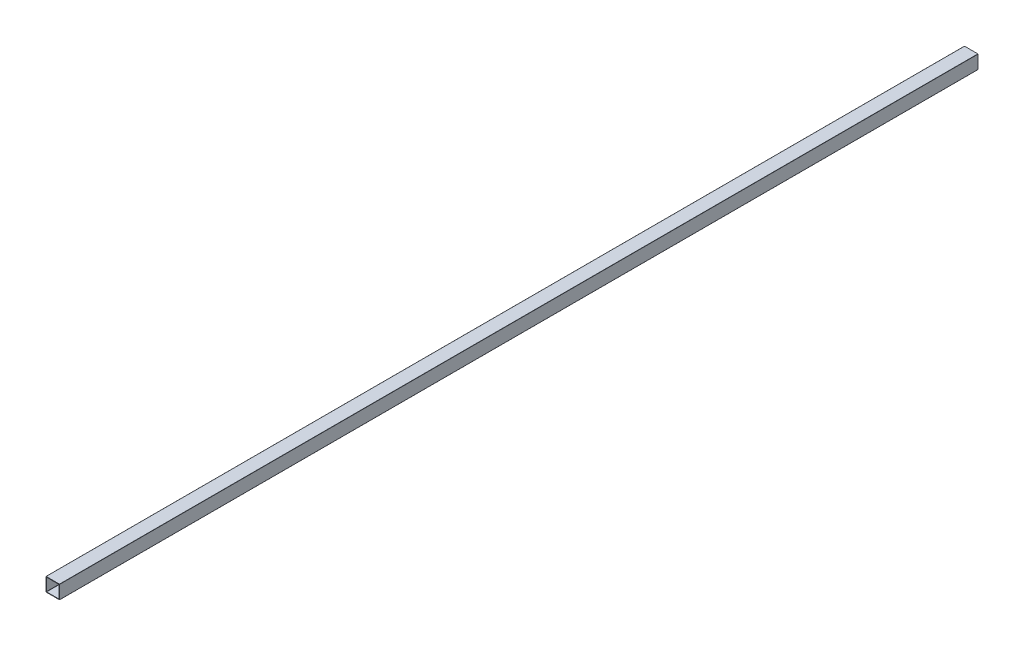
from build123d import *

# Parameters (mm, degrees)
CROQUIS1_W              = 88.9
CROQUIS1_H              = 88.9
CROQUIS1_W_2            = 82.82
CROQUIS1_H_2            = 82.82
SALIENTE_EXTRUIR1_DEPTH = 6000
REDONDEO1_R             = 1


with BuildPart() as part:
    # Croquis1 → Saliente-Extruir1 (new body)
    with BuildSketch(Plane.XY):
        Rectangle(CROQUIS1_W, CROQUIS1_H)
        Rectangle(CROQUIS1_W_2, CROQUIS1_H_2, mode=Mode.SUBTRACT)
    extrude(amount=-SALIENTE_EXTRUIR1_DEPTH)

    # Redondeo1
    redondeo1_edges = [part.edges().sort_by_distance(p)[0] for p in [
        (41.41, -41.41, -3000),
        (-41.41, -41.41, -3000),
        (-41.41, 41.41, -3000),
        (41.41, 41.41, -3000),
        (44.45, -44.45, -3000),
        (-44.45, -44.45, -3000),
        (-44.45, 44.45, -3000),
        (44.45, 44.45, -3000),
    ]]
    fillet(redondeo1_edges, radius=REDONDEO1_R)


solid = part.part
